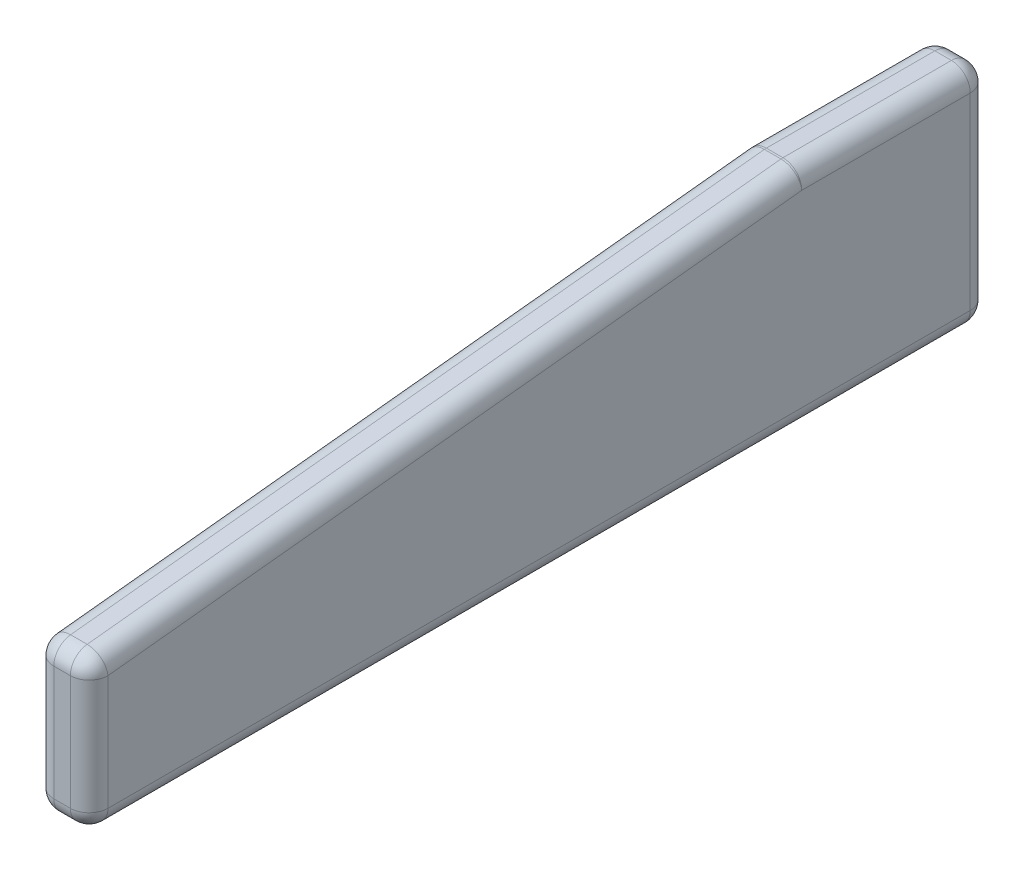
from build123d import *

# Parameters (mm, degrees)
BOSS_EXTRUDE1_DEPTH = 18.288
FILLET1_R           = 6.35


with BuildPart() as part:
    # Sketch1 → Boss-Extrude1 (new body)
    with BuildSketch(Plane(origin=(0, 0, 0), x_dir=(0, 0, -1), z_dir=(1, 0, 0))):
        with BuildLine():
            Line((-166.973473818, -57.646230654), (123.785960254, -57.646230654))
            ThreePointArc((123.785960254, -57.646230654), (128.276088314, -55.786358715), (130.135960254, -51.296230654))
            Line((130.135960254, -51.296230654), (130.135960254, 12.203769346))
            ThreePointArc((130.135960254, 12.203769346), (128.276088314, 16.693897406), (123.785960254, 18.553769346))
            Line((123.785960254, 18.553769346), (66.971101736, 18.553769346))
            ThreePointArc((66.971101736, 18.553769346), (66.636426055, 18.5449437), (66.302680683, 18.518491295))
            Line((66.302680683, 18.518491295), (-167.641894871, -6.244828564))
            ThreePointArc((-167.641894871, -6.244828564), (-171.694012648, -8.31231457), (-173.323473818, -12.559550513))
            Line((-173.323473818, -12.559550513), (-173.323473818, -51.296230654))
            ThreePointArc((-173.323473818, -51.296230654), (-171.463601879, -55.786358715), (-166.973473818, -57.646230654))
        make_face()
    extrude(amount=BOSS_EXTRUDE1_DEPTH)

    # Fillet1
    fillet1_edges = [part.edges().sort_by_distance(p)[0] for p in [
        (18.288, -8.31231457, 171.694012648),
        (0, -19.546230654, -130.135960254),
        (0, -55.786358715, -128.276088314),
        (0, -57.646230654, 21.593756782),
        (0, -55.786358715, 171.463601879),
        (0, -31.927890584, 173.323473818),
        (0, -8.31231457, 171.694012648),
        (0, 6.136831366, 50.669607094),
        (0, 18.5449437, -66.636426055),
        (18.288, -31.927890584, 173.323473818),
        (18.288, -55.786358715, 171.463601879),
        (18.288, -57.646230654, 21.593756782),
        (18.288, -55.786358715, -128.276088314),
        (18.288, -19.546230654, -130.135960254),
        (18.288, 16.693897406, -128.276088314),
        (18.288, 18.553769346, -95.378530995),
        (18.288, 18.5449437, -66.636426055),
        (18.288, 6.136831366, 50.669607094),
        (0, 18.553769346, -95.378530995),
        (0, 16.693897406, -128.276088314),
    ]]
    fillet(fillet1_edges, radius=FILLET1_R)


solid = part.part
